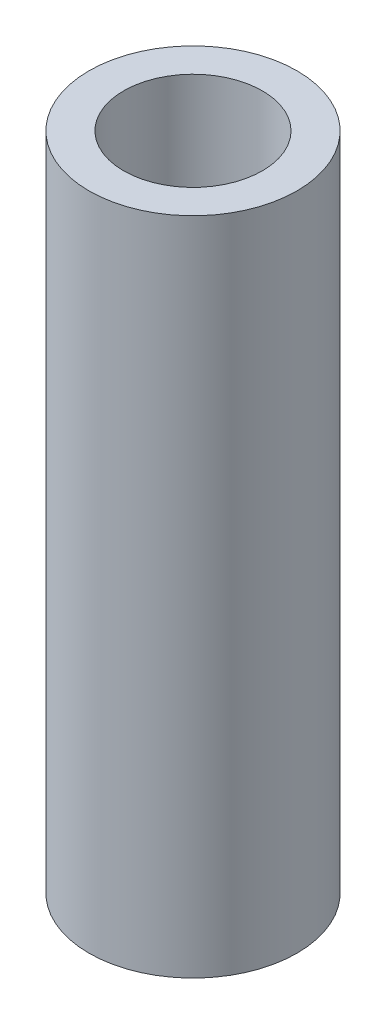
from build123d import *

# Parameters (mm, degrees)
SKETCH1_R           = 4.7625
SKETCH1_R_2         = 3.175
BOSS_EXTRUDE1_DEPTH = 30.226


with BuildPart() as part:
    # Sketch1 → Boss-Extrude1 (new body)
    with BuildSketch(Plane(origin=(0, 0, 0), x_dir=(1, 0, 0), z_dir=(0, 1, 0))):
        with Locations(Location((0, 0, 0), (0, 0, 270))):
            Circle(SKETCH1_R)
        with Locations(Location((0, 0, 0), (0, 0, 270))):
            Circle(SKETCH1_R_2, mode=Mode.SUBTRACT)
    extrude(amount=BOSS_EXTRUDE1_DEPTH)


solid = part.part
